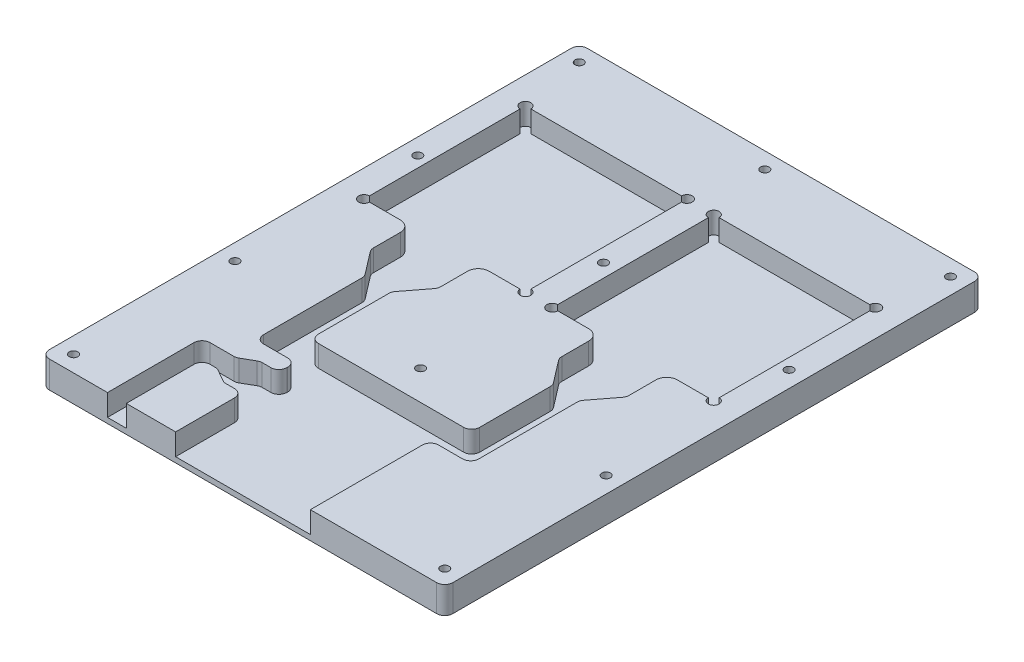
from build123d import *

# Parameters (mm, degrees)
EXTRUDE_1_DEPTH     = 10
CUT_EXTRUDE_1_DEPTH = 8
SKETCH_3_R          = 1.5875
CUT_EXTRUDE_2_DEPTH = 126.39936204


with BuildPart() as part:
    # Эскиз1 → Бобышка-Вытянуть1 (new body)
    with BuildSketch(Plane(origin=(0, 0, 0), x_dir=(1, 0, 0), z_dir=(0, 1, 0))):
        with BuildLine():
            Line((-72, 100), (72, 100))
            ThreePointArc((72, 100), (74.121320344, 99.121320344), (75, 97))
            Line((75, 97), (75, -97))
            ThreePointArc((75, -97), (74.121320344, -99.121320344), (72, -100))
            Line((72, -100), (-72, -100))
            ThreePointArc((-72, -100), (-74.121320344, -99.121320344), (-75, -97))
            Line((-75, -97), (-75, 97))
            ThreePointArc((-75, 97), (-74.121320344, 99.121320344), (-72, 100))
        make_face()
    extrude(amount=EXTRUDE_1_DEPTH)

    # Эскиз2 → Вырез-Вытянуть1 (cut)
    with BuildSketch(Plane(origin=(0, 10, 0), x_dir=(1, 0, 0), z_dir=(0, 1, 0))):
        with BuildLine():
            Line((22.5, 6), (22.5, -3.982244962))
            ThreePointArc((22.5, -3.982244962), (22.659034481, -4.946047285), (23.119276612, -5.807664407))
            Line((23.119276612, -5.807664407), (29.380723388, -13.973882215))
            ThreePointArc((29.380723388, -13.973882215), (29.840965519, -14.835499337), (30, -15.799301661))
            Line((30, -15.799301661), (30, -41.994552887))
            ThreePointArc((30, -41.994552887), (29.121320344, -44.115873231), (27, -44.994552887))
            Line((27, -44.994552887), (-27, -44.994552887))
            ThreePointArc((-27, -44.994552887), (-29.121320344, -44.115873231), (-30, -41.994552887))
            Line((-30, -41.994552887), (-30, -15.799301661))
            ThreePointArc((-30, -15.799301661), (-29.840965519, -14.835499337), (-29.380723388, -13.973882215))
            Line((-29.380723388, -13.973882215), (-23.119276612, -5.807664407))
            ThreePointArc((-23.119276612, -5.807664407), (-22.659034481, -4.946047285), (-22.5, -3.982244962))
            Line((-22.5, -3.982244962), (-22.5, 6))
            ThreePointArc((-22.5, 6), (-21.328427125, 8.828427125), (-18.5, 10))
            Line((-18.5, 10), (-7, 10))
            ThreePointArc((-7, 10), (-3.585786438, 8.585786438), (-5, 12))
            Line((-5, 12), (-5, 68))
            ThreePointArc((-5, 68), (-3.585786438, 71.414213562), (-7, 70))
            Line((-7, 70), (-63, 70))
            ThreePointArc((-63, 70), (-66.414213562, 71.414213562), (-65, 68))
            Line((-65, 68), (-65, 12))
            ThreePointArc((-65, 12), (-66.414213562, 8.585786438), (-63, 10))
            Line((-63, 10), (-51.5, 10))
            ThreePointArc((-51.5, 10), (-48.671572875, 8.828427125), (-47.5, 6))
            Line((-47.5, 6), (-47.5, -3.982244962))
            ThreePointArc((-47.5, -3.982244962), (-47.340965519, -4.946047285), (-46.880723388, -5.807664407))
            Line((-46.880723388, -5.807664407), (-40.619276612, -13.973882215))
            ThreePointArc((-40.619276612, -13.973882215), (-40.159034481, -14.835499337), (-40, -15.799301661))
            Line((-40, -15.799301661), (-40, -52.357484611))
            ThreePointArc((-40, -52.357484611), (-39.121320344, -54.478804954), (-37, -55.357484611))
            Line((-37, -55.357484611), (-28.046989376, -55.357484611))
            ThreePointArc((-28.046989376, -55.357484611), (-25.925669032, -56.236164267), (-25.046989376, -58.357484611))
            Line((-25.046989376, -58.357484611), (-25.046989376, -58.607484611))
            ThreePointArc((-25.046989376, -58.607484611), (-25.925669032, -60.728804954), (-28.046989376, -61.607484611))
            Line((-28.046989376, -61.607484611), (-31.247779241, -61.607484611))
            ThreePointArc((-31.247779241, -61.607484611), (-32.020054596, -61.70858986), (-32.74027589, -62.00509076))
            Line((-32.74027589, -62.00509076), (-37.020569868, -64.459878461))
            ThreePointArc((-37.020569868, -64.459878461), (-37.740791162, -64.756379361), (-38.513066517, -64.857484611))
            Line((-38.513066517, -64.857484611), (-47.380723388, -64.857484611))
            ThreePointArc((-47.380723388, -64.857484611), (-49.502043731, -65.736164267), (-50.380723388, -67.857484611))
            Line((-50.380723388, -67.857484611), (-50.380723388, -100))
            Line((-50.380723388, -100), (-43.380723388, -100))
            Line((-43.380723388, -100), (-43.380723388, -74.857484611))
            ThreePointArc((-43.380723388, -74.857484611), (-42.502043731, -72.736164267), (-40.380723388, -71.857484611))
            Line((-40.380723388, -71.857484611), (-38.513066517, -71.857484611))
            ThreePointArc((-38.513066517, -71.857484611), (-37.740791162, -71.95858986), (-37.020569868, -72.25509076))
            Line((-37.020569868, -72.25509076), (-32.74027589, -74.709878461))
            ThreePointArc((-32.74027589, -74.709878461), (-32.020054596, -75.006379361), (-31.247779241, -75.107484611))
            Line((-31.247779241, -75.107484611), (-28.046989376, -75.107484611))
            ThreePointArc((-28.046989376, -75.107484611), (-25.925669032, -75.986164267), (-25.046989376, -78.107484611))
            Line((-25.046989376, -78.107484611), (-25.046989376, -100))
            Line((-25.046989376, -100), (25.046989376, -100))
            Line((25.046989376, -100), (25.046989376, -78.107484611))
            Line((25.046989376, -78.107484611), (25.046989376, -58.357484611))
            ThreePointArc((25.046989376, -58.357484611), (25.925669032, -56.236164267), (28.046989376, -55.357484611))
            Line((28.046989376, -55.357484611), (37, -55.357484611))
            ThreePointArc((37, -55.357484611), (39.121320344, -54.478804954), (40, -52.357484611))
            Line((40, -52.357484611), (40, -15.799301661))
            ThreePointArc((40, -15.799301661), (40.159034481, -14.835499337), (40.619276612, -13.973882215))
            Line((40.619276612, -13.973882215), (46.880723388, -5.807664407))
            ThreePointArc((46.880723388, -5.807664407), (47.340965519, -4.946047285), (47.5, -3.982244962))
            Line((47.5, -3.982244962), (47.5, 6))
            ThreePointArc((47.5, 6), (48.671572875, 8.828427125), (51.5, 10))
            Line((51.5, 10), (63, 10))
            ThreePointArc((63, 10), (66.414213562, 8.585786438), (65, 12))
            Line((65, 12), (65, 68))
            ThreePointArc((65, 68), (66.414213562, 71.414213562), (63, 70))
            Line((63, 70), (7, 70))
            ThreePointArc((7, 70), (3.585786438, 71.414213562), (5, 68))
            Line((5, 68), (5, 12))
            ThreePointArc((5, 12), (3.585786438, 8.585786438), (7, 10))
            Line((7, 10), (18.5, 10))
            ThreePointArc((18.5, 10), (21.328427125, 8.828427125), (22.5, 6))
        make_face()
    extrude(amount=-CUT_EXTRUDE_1_DEPTH, mode=Mode.SUBTRACT)

    # Эскиз3 → Вырез-Вытянуть2 (cut, through all)
    with BuildSketch(Plane(origin=(0, 10, 0), x_dir=(1, 0, 0), z_dir=(0, 1, 0))):
        with Locations(Location((-69, 94, 0), (0, 0, 270))):
            Circle(SKETCH_3_R)
        with Locations(Location((0, 94, 0), (0, 0, 270))):
            Circle(SKETCH_3_R)
        with Locations(Location((69, 94, 0), (0, 0, 270))):
            Circle(SKETCH_3_R)
        with Locations(Location((-69, -34, 0), (0, 0, 90))):
            Circle(SKETCH_3_R)
        with Locations(Location((69, -34, 0), (0, 0, 90))):
            Circle(SKETCH_3_R)
        with Locations(Location((0, -34, 0), (0, 0, 90))):
            Circle(SKETCH_3_R)
        with Locations(Location((69, -94, 0), (0, 0, 90))):
            Circle(SKETCH_3_R)
        with Locations(Location((-69, -94, 0), (0, 0, 90))):
            Circle(SKETCH_3_R)
        with Locations(Location((0, 34, 0), (0, 0, 270))):
            Circle(SKETCH_3_R)
        with Locations(Location((69, 34, 0), (0, 0, 270))):
            Circle(SKETCH_3_R)
        with Locations(Location((-69, 34, 0), (0, 0, 270))):
            Circle(SKETCH_3_R)
    extrude(amount=-CUT_EXTRUDE_2_DEPTH, mode=Mode.SUBTRACT)


solid = part.part
